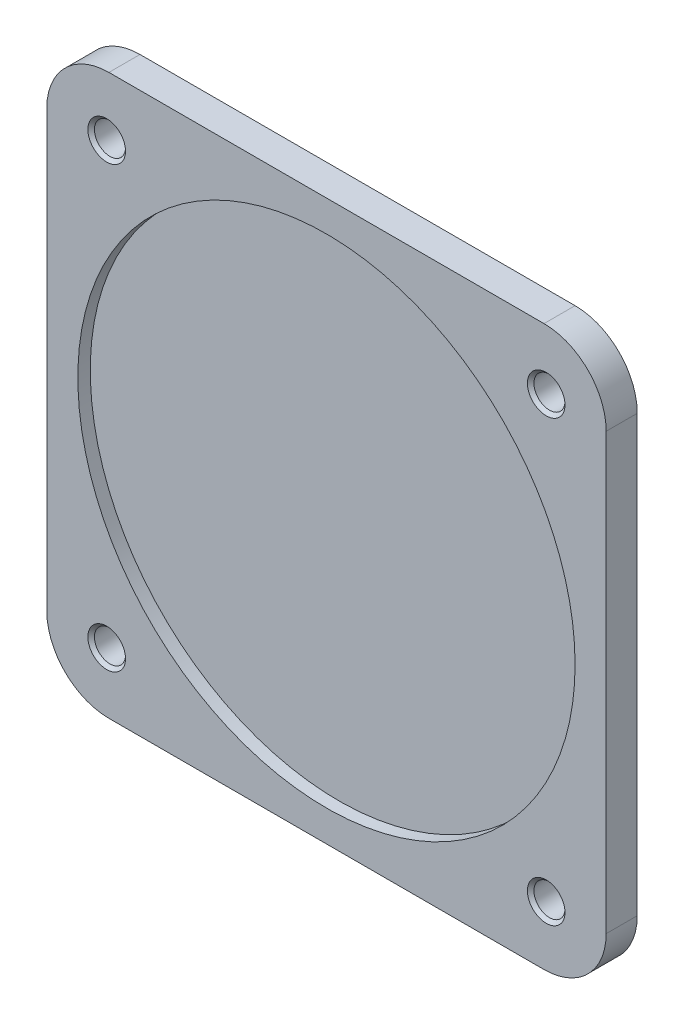
from build123d import *

# Parameters (mm, degrees)
SKETCH_1_W                   = 90
SKETCH_1_H                   = 90
EXTRUDE_1_DEPTH              = 5
FILLET_1_R                   = 10
HOLE_WIZARD_M6_1_D           = 5
HOLE_WIZARD_M6_1_DEPTH       = 17
HOLE_WIZARD_M6_1_CSINK_D     = 6.05
HOLE_WIZARD_M6_1_CSINK_ANGLE = 90
HOLE_WIZARD_M6_1_TIP         = 1.502151548
SKETCH_4_R                   = 40
CUT_EXTRUDE_1_DEPTH          = 2


with BuildPart() as part:
    # 草图1 → 凸台-拉伸1 (new body)
    with BuildSketch(Plane.XY):
        Rectangle(SKETCH_1_W, SKETCH_1_H)
    extrude(amount=EXTRUDE_1_DEPTH)

    # 圆角1
    fillet_1_edges = [part.edges().sort_by_distance(p)[0] for p in [
        (45, -45, 2.5),
        (-45, -45, 2.5),
        (-45, 45, 2.5),
        (45, 45, 2.5),
    ]]
    fillet(fillet_1_edges, radius=FILLET_1_R)

    # M6 螺纹孔1
    with Locations(Plane.XY.offset(5)):
        with Locations((35.355339059, -35.355339059), (-35.355339059, 35.355339059), (35.355339059, 35.355339059), (-35.355339059, -35.355339059)):
            CounterSinkHole(HOLE_WIZARD_M6_1_D / 2, HOLE_WIZARD_M6_1_CSINK_D / 2, depth=HOLE_WIZARD_M6_1_DEPTH, counter_sink_angle=HOLE_WIZARD_M6_1_CSINK_ANGLE)
            with Locations((0, 0, -(HOLE_WIZARD_M6_1_DEPTH + HOLE_WIZARD_M6_1_TIP / 2))):  # 118° drill point
                Cone(0, HOLE_WIZARD_M6_1_D / 2, HOLE_WIZARD_M6_1_TIP, mode=Mode.SUBTRACT)

    # 草图4 → 切除-拉伸1 (cut)
    with BuildSketch(Plane.XY.offset(5)):
        Circle(SKETCH_4_R)
    extrude(amount=-CUT_EXTRUDE_1_DEPTH, mode=Mode.SUBTRACT)


solid = part.part
